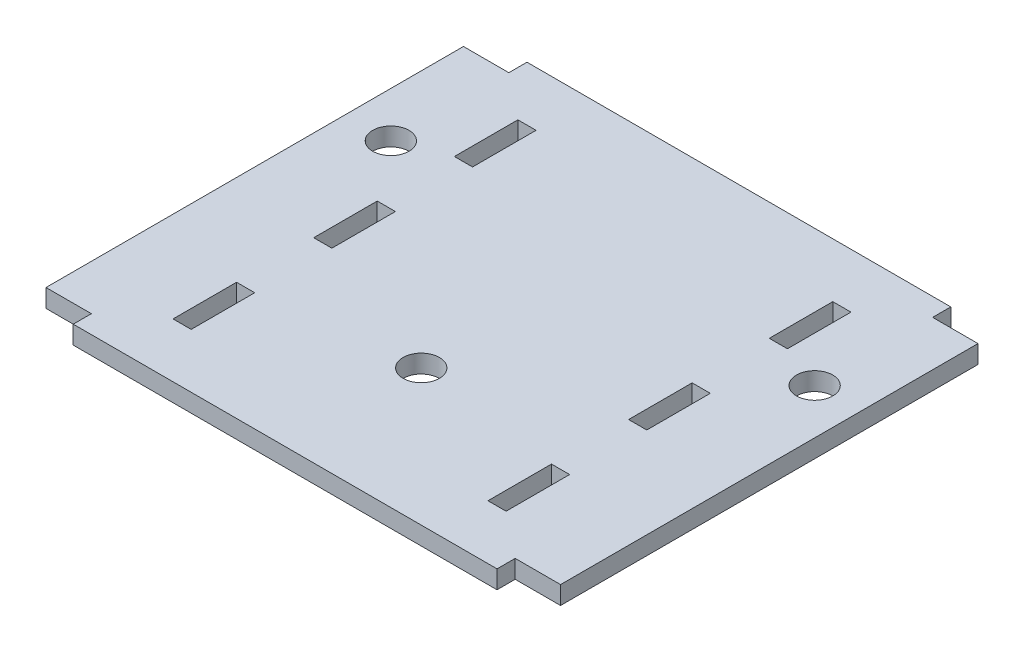
from build123d import *

# Parameters (mm, degrees)
SKETCH1_W           = 2
SKETCH1_H           = 7
SKETCH1_R           = 2
BOSS_EXTRUDE1_DEPTH = 2
SKETCH2_W           = 23.15
SKETCH2_H           = 50
CUT_EXTRUDE1_DEPTH  = 10


with BuildPart() as part:
    # Sketch1 → Boss-Extrude1 (new body)
    with BuildSketch(Plane(origin=(0, 0, 0), x_dir=(1, 0, 0), z_dir=(0, 1, 0))):
        Polygon((-47.649453113, 2.019339096), (-70.799453113, 2.019339096), (-70.799453113, -47.980660904), (-47.649453113, -47.980660904), (-47.649453113, -45.980660904), (-42.649453113, -45.980660904), (-42.649453113, -47.980660904), (4.050546887, -47.980660904), (4.050546887, -45.980660904), (9.050546887, -45.980660904), (9.050546887, -47.980660904), (32.200546887, -47.980660904), (32.200546887, 2.019339096), (9.050546887, 2.019339096), (9.050546887, 0.019339096), (4.050546887, 0.019339096), (4.050546887, 2.019339096), (-42.649453113, 2.019339096), (-42.649453113, 0.019339096), (-47.649453113, 0.019339096), align=None)
        with Locations((-36.649453113, -38.480660904)):
            Rectangle(SKETCH1_W, SKETCH1_H, mode=Mode.SUBTRACT)
        with Locations((-1.949453113, -38.480660904)):
            Rectangle(SKETCH1_W, SKETCH1_H, mode=Mode.SUBTRACT)
        with Locations(Location((-19.299453113, -32.980660904, 0), (0, 0, 270))):
            Circle(SKETCH1_R, mode=Mode.SUBTRACT)
        with Locations((-36.649453113, -22.980660904)):
            Rectangle(SKETCH1_W, SKETCH1_H, mode=Mode.SUBTRACT)
        with Locations(Location((-42.649453113, -12.980660904, 0), (0, 0, 270))):
            Circle(SKETCH1_R, mode=Mode.SUBTRACT)
        with Locations((-36.649453113, -7.480660904)):
            Rectangle(SKETCH1_W, SKETCH1_H, mode=Mode.SUBTRACT)
        with Locations((-1.949453113, -22.980660904)):
            Rectangle(SKETCH1_W, SKETCH1_H, mode=Mode.SUBTRACT)
        with Locations(Location((4.050546887, -12.980660904, 0), (0, 0, 270))):
            Circle(SKETCH1_R, mode=Mode.SUBTRACT)
        with Locations((-1.949453113, -7.480660904)):
            Rectangle(SKETCH1_W, SKETCH1_H, mode=Mode.SUBTRACT)
    extrude(amount=BOSS_EXTRUDE1_DEPTH)

    # Sketch2 → Cut-Extrude1 (cut)
    with BuildSketch(Plane(origin=(0, 0, 0), x_dir=(-1, 0, 0), z_dir=(0, -1, 0))):
        with Locations((59.224453113, -22.980660904)):
            Rectangle(SKETCH2_W, SKETCH2_H)
        with Locations((-20.625546887, -22.980660904)):
            Rectangle(SKETCH2_W, SKETCH2_H)
    extrude(amount=-CUT_EXTRUDE1_DEPTH, mode=Mode.SUBTRACT)


solid = part.part
